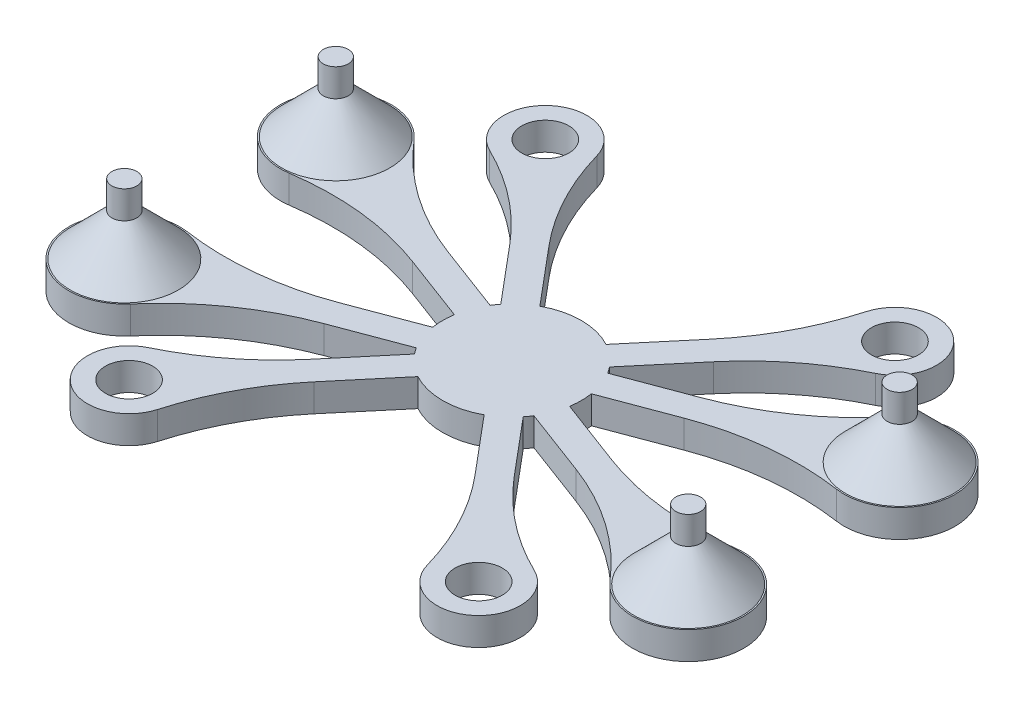
from build123d import *

# Parameters (mm, degrees)
SKETCH1_R            = 5
BOSS_EXTRUDE1_DEPTH  = 2
FILLET1_R            = 20
M3_CLEARANCE_HOLE2_D = 3.4
SKETCH5_R            = 0.9
BOSS_EXTRUDE2_DEPTH  = 5
CHAMFER1_SIZE        = 3


with BuildPart() as part:
    # Sketch1 → Boss-Extrude1 (new body)
    with BuildSketch(Plane(origin=(0, 0, 0), x_dir=(1, 0, 0), z_dir=(0, 1, 0))):
        with Locations((21.6, 9)):
            Circle(SKETCH1_R)
        with BuildLine():
            Line((24.81621403, 11.274080729), (33.146482921, 21.191067504))
            ThreePointArc((33.146482921, 21.191067504), (36.129576259, 26.297114594), (31.615073192, 22.477451677))
            Line((31.615073192, 22.477451677), (21.6, 10.554745497))
            Line((21.6, 10.554745497), (11.584926808, 22.477451677))
            ThreePointArc((11.584926808, 22.477451677), (7.070423741, 26.297114594), (10.053517079, 21.191067504))
            Line((10.053517079, 21.191067504), (18.38378597, 11.274080729))
            Line((18.38378597, 11.274080729), (5.257510753, 16.196433936))
            ThreePointArc((5.257510753, 16.196433936), (-2.46531671, 18.024493766), (4.55526387, 14.323775581))
            Line((4.55526387, 14.323775581), (18.751998752, 9))
            Line((18.751998752, 9), (4.55526387, 3.676224419))
            ThreePointArc((4.55526387, 3.676224419), (-2.46531671, -0.024493766), (5.257510753, 1.803566064))
            Line((5.257510753, 1.803566064), (18.38378597, 6.725919271))
            Line((18.38378597, 6.725919271), (10.053517079, -3.191067504))
            ThreePointArc((10.053517079, -3.191067504), (7.070423741, -8.297114594), (11.584926808, -4.477451677))
            Line((11.584926808, -4.477451677), (21.6, 7.445254503))
            Line((21.6, 7.445254503), (31.615073192, -4.477451677))
            ThreePointArc((31.615073192, -4.477451677), (36.129576259, -8.297114594), (33.146482921, -3.191067504))
            Line((33.146482921, -3.191067504), (24.81621403, 6.725919271))
            Line((24.81621403, 6.725919271), (37.942489247, 1.803566064))
            ThreePointArc((37.942489247, 1.803566064), (45.66531671, -0.024493766), (38.64473613, 3.676224419))
            Line((38.64473613, 3.676224419), (24.448001248, 9))
            Line((24.448001248, 9), (38.64473613, 14.323775581))
            ThreePointArc((38.64473613, 14.323775581), (45.66531671, 18.024493766), (37.942489247, 16.196433936))
            Line((37.942489247, 16.196433936), (24.81621403, 11.274080729))
        make_face()
    extrude(amount=BOSS_EXTRUDE1_DEPTH)

    # Fillet1
    fillet1_edges = [part.edges().sort_by_distance(p)[0] for p in [
        (5.257510753, 1, -16.196433936),
        (4.55526387, 1, -14.323775581),
        (4.55526387, 1, -3.676224419),
        (5.257510753, 1, -1.803566064),
        (10.053517079, 1, 3.191067504),
        (11.584926808, 1, 4.477451677),
        (31.615073192, 1, 4.477451677),
        (33.146482921, 1, 3.191067504),
        (37.942489247, 1, -1.803566064),
        (38.64473613, 1, -3.676224419),
        (38.64473613, 1, -14.323775581),
        (37.942489247, 1, -16.196433936),
        (33.146482921, 1, -21.191067504),
        (31.615073192, 1, -22.477451677),
        (11.584926808, 1, -22.477451677),
        (10.053517079, 1, -21.191067504),
    ]]
    fillet(fillet1_edges, radius=FILLET1_R)

    # M3 Clearance Hole2 (through all)
    with Locations(Plane(origin=(0, 2, 0), x_dir=(1, 0, 0), z_dir=(0, 1, 0))):
        with Locations((9, -6), (34.2, -6), (34.2, 24), (9, 24)):
            Hole(M3_CLEARANCE_HOLE2_D / 2)

    # Sketch5 → Boss-Extrude2 (add)
    with BuildSketch(Plane(origin=(0, 2, 0), x_dir=(1, 0, 0), z_dir=(0, 1, 0))):
        with Locations(Location((1.28, 1.38, 0), (0, 0, 270))):
            Circle(SKETCH5_R)
        with Locations(Location((41.92, 1.38, 0), (0, 0, 270))):
            Circle(SKETCH5_R)
        with Locations(Location((41.92, 16.62, 0), (0, 0, 270))):
            Circle(SKETCH5_R)
        with Locations(Location((1.28, 16.62, 0), (0, 0, 270))):
            Circle(SKETCH5_R)
    extrude(amount=BOSS_EXTRUDE2_DEPTH)

    # Chamfer1
    chamfer1_edges = [part.edges().sort_by_distance(p)[0] for p in [
        (1.28, 2, -2.28),
        (41.92, 2, -2.28),
        (41.92, 2, -17.52),
        (1.28, 2, -17.52),
    ]]
    chamfer(chamfer1_edges, length=CHAMFER1_SIZE)


solid = part.part
